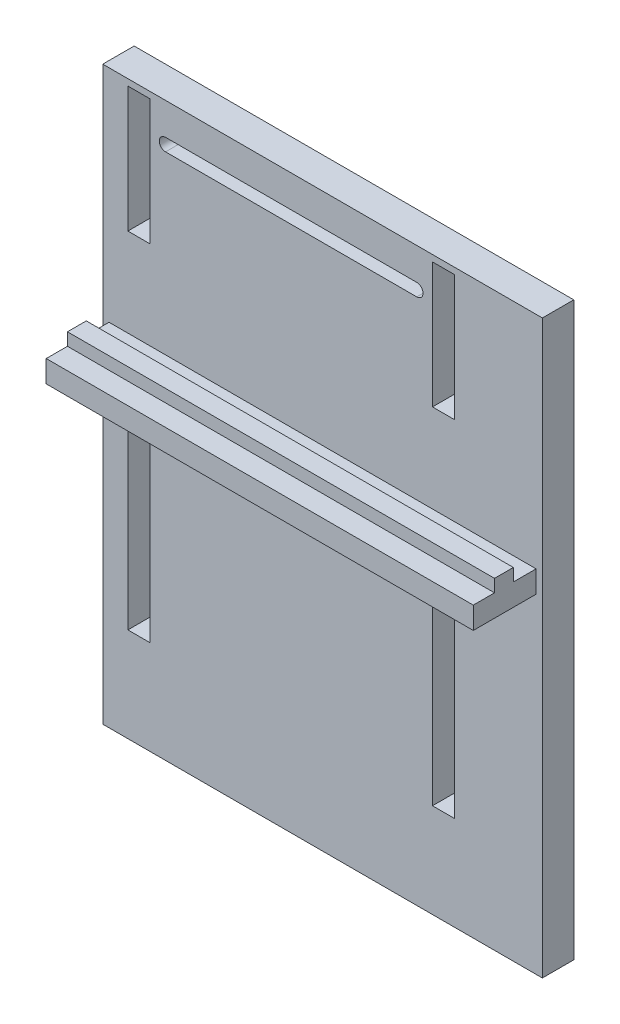
from build123d import *

# Parameters (mm, degrees)
SKETCH1_W           = 60
SKETCH1_H           = 100
SKETCH1_W_2         = 3.5
SKETCH1_H_2         = 30
SKETCH1_H_3         = 20
BOSS_EXTRUDE1_DEPTH = 5
SKETCH2_W           = 58
SKETCH2_H           = 3.5
BOSS_EXTRUDE2_DEPTH = 10
SKETCH3_W           = 52
SKETCH3_H           = 3
BOSS_EXTRUDE3_DEPTH = 2
SKETCH4_R           = 2
BOSS_EXTRUDE4_DEPTH = 20
CUT_EXTRUDE1_DEPTH  = 64.442887702
SKETCH6_W           = 3
SKETCH6_H           = 2
BOSS_EXTRUDE5_DEPTH = 3
SKETCH7_W           = 3
SKETCH7_H           = 2
BOSS_EXTRUDE6_DEPTH = 3
SKETCH8_W           = 5
SKETCH8_H           = 100
BOSS_EXTRUDE7_DEPTH = 10
BOSS_EXTRUDE8_DEPTH = 10
SKETCH11_W          = 70
SKETCH11_H          = 8.980295192
CUT_EXTRUDE2_DEPTH  = 69.738635424


with BuildPart() as part:
    # Sketch1 → Boss-Extrude1 (new body)
    with BuildSketch(Plane.XY):
        Rectangle(SKETCH1_W, SKETCH1_H)
        with Locations((24.25, -20)):
            Rectangle(SKETCH1_W_2, SKETCH1_H_2, mode=Mode.SUBTRACT)
        with Locations((-24.25, -20)):
            Rectangle(SKETCH1_W_2, SKETCH1_H_2, mode=Mode.SUBTRACT)
        with Locations((24.25, 30)):
            Rectangle(SKETCH1_W_2, SKETCH1_H_3, mode=Mode.SUBTRACT)
        with Locations((-24.25, 30)):
            Rectangle(SKETCH1_W_2, SKETCH1_H_3, mode=Mode.SUBTRACT)
    extrude(amount=BOSS_EXTRUDE1_DEPTH)

    # Sketch2 → Boss-Extrude2 (add)
    with BuildSketch(Plane.XY.offset(5)):
        with Locations((0, 4.173976932)):
            Rectangle(SKETCH2_W, SKETCH2_H)
    extrude(amount=BOSS_EXTRUDE2_DEPTH)

    # Sketch3 → Boss-Extrude3 (add)
    with BuildSketch(Plane(origin=(0, 5.923976932, 0), x_dir=(1, 0, 0), z_dir=(0, 1, 0))):
        with Locations((0, -10.12126967)):
            Rectangle(SKETCH3_W, SKETCH3_H)
    extrude(amount=BOSS_EXTRUDE3_DEPTH)

    # Sketch4 → Boss-Extrude4 (add)
    with BuildSketch(Plane(origin=(0, 0, 0), x_dir=(-1, 0, 0), z_dir=(0, 0, -1))):
        with Locations((15, 0)):
            Circle(SKETCH4_R)
        with Locations((-15, 0)):
            Circle(SKETCH4_R)
    extrude(amount=BOSS_EXTRUDE4_DEPTH)

    # Sketch5 → Cut-Extrude1 (cut, through all)
    with BuildSketch(Plane.XY.offset(5)):
        with BuildLine():
            Line((-20, 35.923976932), (20, 35.923976932))
            ThreePointArc((20, 35.923976932), (21, 34.923976932), (20, 33.923976932))
            Line((20, 33.923976932), (-20, 33.923976932))
            ThreePointArc((-20, 33.923976932), (-21, 34.923976932), (-20, 35.923976932))
        make_face()
    extrude(amount=-CUT_EXTRUDE1_DEPTH, mode=Mode.SUBTRACT)

    # Sketch6 → Boss-Extrude5 (add)
    with BuildSketch(Plane(origin=(26, 0, 0), x_dir=(0, 0, -1), z_dir=(1, 0, 0))):
        with Locations((-10.12126967, 6.923976932)):
            Rectangle(SKETCH6_W, SKETCH6_H)
    extrude(amount=BOSS_EXTRUDE5_DEPTH)

    # Sketch7 → Boss-Extrude6 (add)
    with BuildSketch(Plane.ZY.offset(26)):
        with Locations((10.12126967, 6.923976932)):
            Rectangle(SKETCH7_W, SKETCH7_H)
    extrude(amount=BOSS_EXTRUDE6_DEPTH)

    # Sketch8 → Boss-Extrude7 (add)
    with BuildSketch(Plane(origin=(30, 0, 0), x_dir=(0, 0, -1), z_dir=(1, 0, 0))):
        with Locations((-2.5, 0)):
            Rectangle(SKETCH8_W, SKETCH8_H)
    extrude(amount=BOSS_EXTRUDE7_DEPTH)

    # Sketch9 → Boss-Extrude8 (add)
    with BuildSketch(Plane(origin=(29, 0, 0), x_dir=(0, 0, -1), z_dir=(1, 0, 0))):
        Polygon((-5, 2.423976932), (-5, 5.923976932), (-8.62126967, 5.923976932), (-8.62126967, 7.923976932), (-11.62126967, 7.923976932), (-11.62126967, 5.923976932), (-15, 5.923976932), (-15, 2.423976932), align=None)
    extrude(amount=BOSS_EXTRUDE8_DEPTH)

    # Sketch11 → Cut-Extrude2 (cut, through all)
    with BuildSketch(Plane.XY.offset(5)):
        with Locations((5, 45.509852404)):
            Rectangle(SKETCH11_W, SKETCH11_H)
    extrude(amount=-CUT_EXTRUDE2_DEPTH, mode=Mode.SUBTRACT)


solid = part.part
